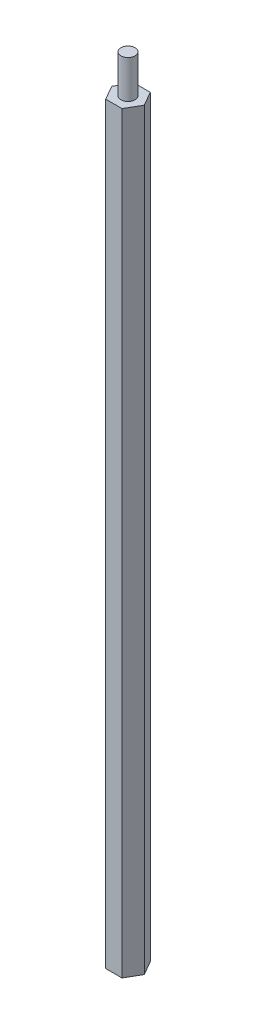
from build123d import *

# Parameters (mm, degrees)
BOSS_EXTRUDE1_DEPTH = 160
SKETCH5_R           = 1.5
BOSS_EXTRUDE2_DEPTH = 8.091605471
SKETCH6_R           = 1.5
CUT_EXTRUDE1_DEPTH  = 4


with BuildPart() as part:
    # Sketch3 → Boss-Extrude1 (new body)
    with BuildSketch(Plane(origin=(0, 0, 0), x_dir=(1, 0, 0), z_dir=(0, 1, 0))):
        Polygon((-3.464101615, 0), (-1.732050808, -3), (1.732050808, -3), (3.464101615, 0), (1.732050808, 3), (-1.732050808, 3), align=None)
    extrude(amount=BOSS_EXTRUDE1_DEPTH)

    # Sketch5 → Boss-Extrude2 (add)
    with BuildSketch(Plane(origin=(0, 160, 0), x_dir=(1, 0, 0), z_dir=(0, 1, 0))):
        with Locations(Location((0, 0, 0), (0, 0, 270))):
            Circle(SKETCH5_R)
    extrude(amount=BOSS_EXTRUDE2_DEPTH)

    # Sketch6 → Cut-Extrude1 (cut)
    with BuildSketch(Plane.XZ):
        with Locations(Location((0, 0, 0), (0, 0, 90))):
            Circle(SKETCH6_R)
    extrude(amount=-CUT_EXTRUDE1_DEPTH, mode=Mode.SUBTRACT)


solid = part.part
